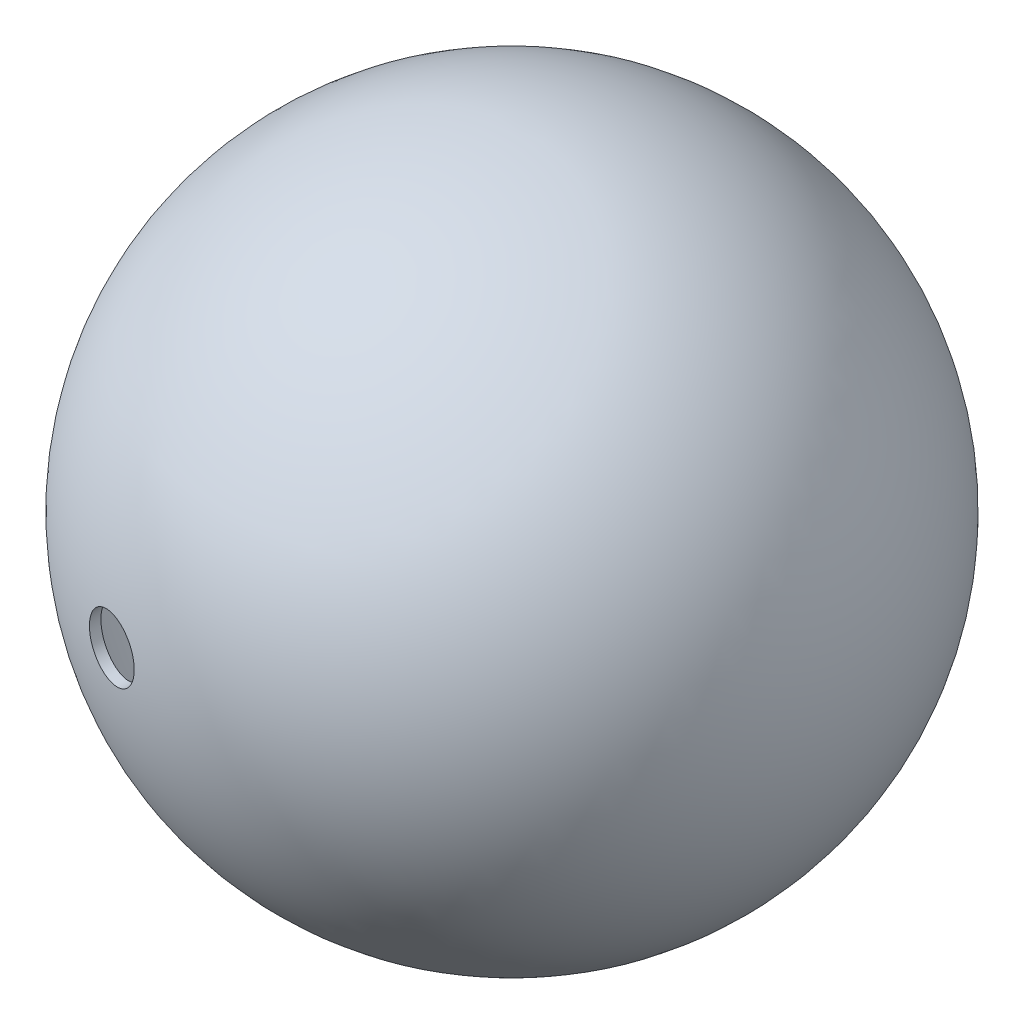
from build123d import *

# Parameters (mm, degrees)
SKETCH2_R          = 1.1
CUT_EXTRUDE1_DEPTH = 100


with BuildPart() as part:
    # Sketch1 → Revolve1 (revolve)
    with BuildSketch(Plane.XY):
        with BuildLine():
            ThreePointArc((0, -11.99), (11.99, 0), (0, 11.99))
            Line((0, 11.99), (0, 11.6))
            ThreePointArc((0, 11.6), (11.6, 0), (0, -11.6))
            Line((0, -11.6), (0, -11.99))
        make_face()
    revolve(axis=Axis((0, 12.475613276, 0), (0, -1, 0)))

    # Sketch2 → Cut-Extrude1 (cut)
    with BuildSketch(Plane.XY):
        with Locations((-3, 0)):
            Circle(SKETCH2_R)
    extrude(amount=CUT_EXTRUDE1_DEPTH, mode=Mode.SUBTRACT)

    # Sketch3 → Cut-Revolve1 (revolve, cut)
    with BuildSketch(Plane(origin=(0, 0, 0), x_dir=(1, 0, 0), z_dir=(0, 1, 0))):
        with BuildLine():
            ThreePointArc((0, 8.6), (3, 11.6), (0, 14.6))
            Line((0, 14.6), (0, 8.6))
        make_face()
    revolve(axis=Axis((0, 0, -15.213768508), (0, 0, 1)), mode=Mode.SUBTRACT)


solid = part.part
